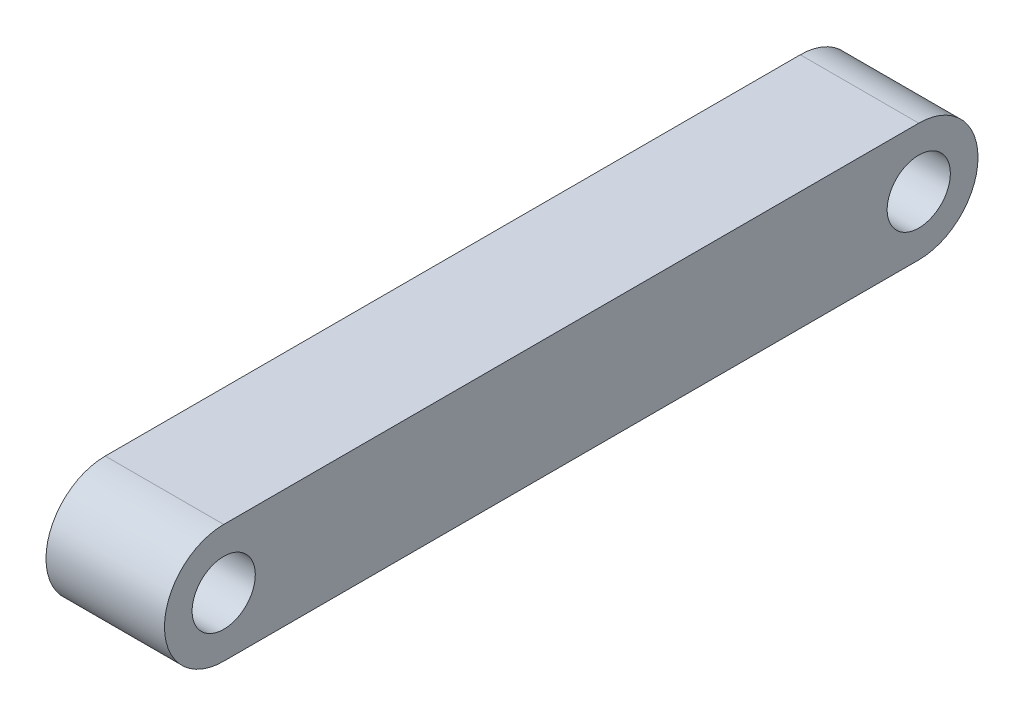
from build123d import *

# Parameters (mm, degrees)
SKETCH1_R           = 4
BOSS_EXTRUDE1_DEPTH = 7.5


with BuildPart() as part:
    # Sketch1 → Boss-Extrude1 (new, symmetric)
    with BuildSketch(Plane(origin=(0, 0, 0), x_dir=(0, 0, -1), z_dir=(1, 0, 0))):
        with BuildLine():
            Line((-44, 7.5), (44, 7.5))
            ThreePointArc((44, 7.5), (51.5, 0), (44, -7.5))
            Line((44, -7.5), (-44, -7.5))
            ThreePointArc((-44, -7.5), (-51.5, 0), (-44, 7.5))
        make_face()
        with Locations((-44, 0)):
            Circle(SKETCH1_R, mode=Mode.SUBTRACT)
        with Locations((44, 0)):
            Circle(SKETCH1_R, mode=Mode.SUBTRACT)
    extrude(amount=BOSS_EXTRUDE1_DEPTH, both=True)


solid = part.part
